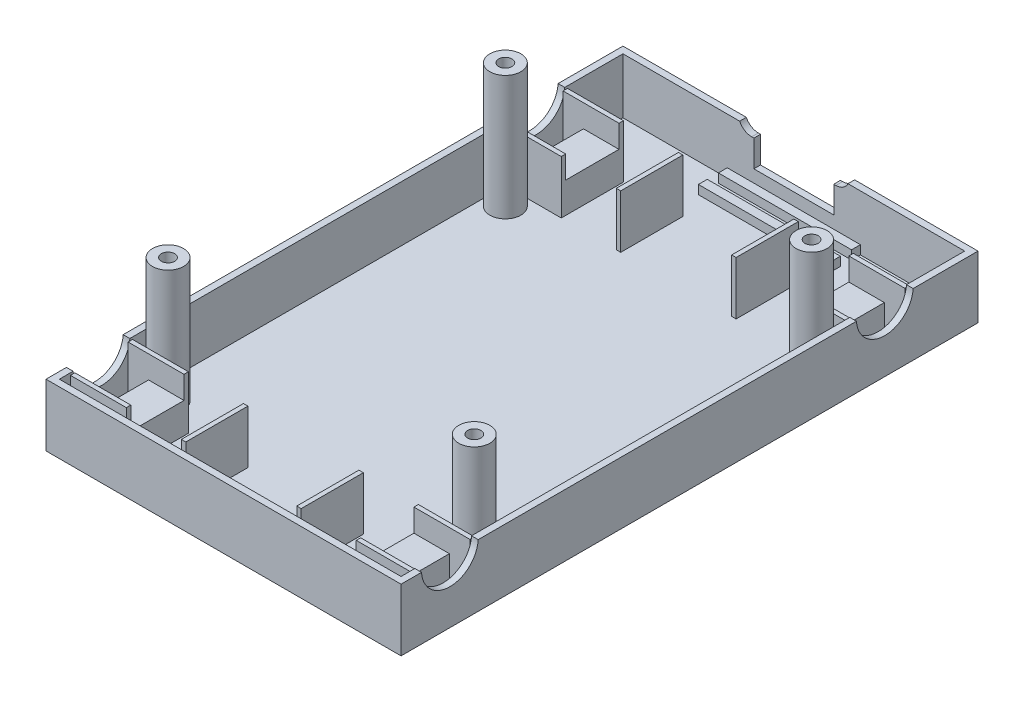
from build123d import *

# Parameters (mm, degrees)
SKETCH_262_W         = 80
SKETCH_262_H         = 130
EXTRUDE_1_DEPTH      = 14
SKETCH_1_W           = 77
SKETCH_1_H           = 127
CUT_EXTRUDE_1_DEPTH  = 12.5
CUT_EXTRUDE_2_DEPTH  = 2
SKETCH_10_W          = 8
SKETCH_10_H          = 12
EXTRUDE_2_DEPTH      = 6.9
SKETCH_11_W          = 12.6
SKETCH_11_H          = 1
EXTRUDE_3_DEPTH      = 12
SKETCH_13_R          = 3.5
EXTRUDE_4_DEPTH      = 28
CUT_EXTRUDE_9_DEPTH  = 1.5
CUT_EXTRUDE_START    = -1.5
CUT_EXTRUDE_10_DEPTH = 1.5
CUT_EXTRUDE_11_DEPTH = 1.5
CUT_EXTRUDE_12_DEPTH = 1.5
SKETCH_15_R          = 1.5
CUT_EXTRUDE_14_DEPTH = 19.5
SKETCH_16_W          = 30
SKETCH_16_H          = 2
EXTRUDE_5_DEPTH      = 2
SKETCH_17_W          = 1
SKETCH_17_H          = 14
EXTRUDE_6_DEPTH      = 12


with BuildPart() as part:
    # Sketch 262 → Бобышка-Вытянуть1 (new body)
    with BuildSketch(Plane(origin=(0, 0, 0), x_dir=(1, 0, 0), z_dir=(0, 1, 0))):
        Rectangle(SKETCH_262_W, SKETCH_262_H)
    extrude(amount=EXTRUDE_1_DEPTH)

    # Эскиз1 → Вырез-Вытянуть1 (cut)
    with BuildSketch(Plane(origin=(0, 14, 0), x_dir=(1, 0, 0), z_dir=(0, 1, 0))):
        Rectangle(SKETCH_1_W, SKETCH_1_H)
    extrude(amount=-CUT_EXTRUDE_1_DEPTH, mode=Mode.SUBTRACT)

    # Эскиз2 → Вырез-Вытянуть2 (cut)
    with BuildSketch(Plane.XY.offset(-63.5)):
        with BuildLine():
            Line((-9, 18.3), (-9.5, 18.3))
            ThreePointArc((-9.5, 18.3), (-12.5, 15.3), (-9.5, 12.3))
            Line((-9.5, 12.3), (-9, 12.3))
            Line((-9, 12.3), (-9, 6.3))
            Line((-9, 6.3), (9, 6.3))
            Line((9, 6.3), (9, 12.3))
            Line((9, 12.3), (9.5, 12.3))
            ThreePointArc((9.5, 12.3), (12.5, 15.3), (9.5, 18.3))
            Line((9.5, 18.3), (9, 18.3))
            Line((9, 18.3), (9, 24.3))
            Line((9, 24.3), (-9, 24.3))
            Line((-9, 24.3), (-9, 18.3))
        make_face()
    extrude(amount=-CUT_EXTRUDE_2_DEPTH, mode=Mode.SUBTRACT)

    # Эскиз10 → Бобышка-Вытянуть2 (add)
    with BuildSketch(Plane(origin=(0, 1.5, 0), x_dir=(1, 0, 0), z_dir=(0, 1, 0))):
        with Locations((-29.9, 44)):
            Rectangle(SKETCH_10_W, SKETCH_10_H)
        with Locations((29.9, 44)):
            Rectangle(SKETCH_10_W, SKETCH_10_H)
        with Locations((-29.9, -54)):
            Rectangle(SKETCH_10_W, SKETCH_10_H)
        with Locations((29.9, -54)):
            Rectangle(SKETCH_10_W, SKETCH_10_H)
    extrude(amount=EXTRUDE_2_DEPTH)

    # Эскиз11 → Бобышка-Вытянуть3 (add)
    with BuildSketch(Plane(origin=(0, 1.5, 0), x_dir=(1, 0, 0), z_dir=(0, 1, 0))):
        with Locations((-32.2, 50.5)):
            Rectangle(SKETCH_11_W, SKETCH_11_H)
        with Locations((32.2, 50.5)):
            Rectangle(SKETCH_11_W, SKETCH_11_H)
        with Locations((-32.2, 37.5)):
            Rectangle(SKETCH_11_W, SKETCH_11_H)
        with Locations((32.2, 37.5)):
            Rectangle(SKETCH_11_W, SKETCH_11_H)
        with Locations((32.2, -47.5)):
            Rectangle(SKETCH_11_W, SKETCH_11_H)
        with Locations((32.2, -60.5)):
            Rectangle(SKETCH_11_W, SKETCH_11_H)
        with Locations((-32.2, -47.5)):
            Rectangle(SKETCH_11_W, SKETCH_11_H)
        with Locations((-32.2, -60.5)):
            Rectangle(SKETCH_11_W, SKETCH_11_H)
    extrude(amount=EXTRUDE_3_DEPTH)

    # Эскиз13 → Бобышка-Вытянуть4 (add)
    with BuildSketch(Plane(origin=(0, 1.5, 0), x_dir=(1, 0, 0), z_dir=(0, 1, 0))):
        with Locations(Location((-34.5, 33, 0), (0, 0, 270))):
            Circle(SKETCH_13_R)
        with Locations(Location((34.5, 33, 0), (0, 0, 270))):
            Circle(SKETCH_13_R)
        with Locations(Location((-34.5, -43, 0), (0, 0, 270))):
            Circle(SKETCH_13_R)
        with Locations(Location((34.5, -43, 0), (0, 0, 270))):
            Circle(SKETCH_13_R)
    extrude(amount=EXTRUDE_4_DEPTH)

    # Эскиз5 → Вырез-Вытянуть9 (cut)
    with BuildSketch(Plane.ZY.offset(40)):
        with BuildLine():
            Line((57.199546833, 20.146147769), (57.196157558, 19.944779244))
            ThreePointArc((57.196157558, 19.944779244), (54, 8), (50.803842442, 19.944779244))
            Line((50.803842442, 19.944779244), (50.800453167, 20.146147769))
            ThreePointArc((50.800453167, 20.146147769), (54, 23.4), (57.199546833, 20.146147769))
        make_face()
    extrude(amount=-CUT_EXTRUDE_9_DEPTH, mode=Mode.SUBTRACT)

    # Эскиз6 → Вырез-Вытянуть10 (cut)
    with BuildSketch(Plane(origin=(40, 0, 0), x_dir=(0, 0, -1), z_dir=(1, 0, 0)).offset(CUT_EXTRUDE_START)):
        with BuildLine():
            Line((-50.8, 20.2), (-50.8, 19.942562584))
            ThreePointArc((-50.8, 19.942562584), (-54, 8), (-57.2, 19.942562584))
            Line((-57.2, 19.942562584), (-57.2, 20.2))
            ThreePointArc((-57.2, 20.2), (-54, 23.4), (-50.8, 20.2))
        make_face()
    extrude(amount=CUT_EXTRUDE_10_DEPTH, mode=Mode.SUBTRACT)

    # Эскиз3 → Вырез-Вытянуть11 (cut)
    with BuildSketch(Plane.ZY.offset(40)):
        with BuildLine():
            Line((-40.8, 20.2), (-40.8, 19.942562584))
            ThreePointArc((-40.8, 19.942562584), (-44, 8), (-47.2, 19.942562584))
            Line((-47.2, 19.942562584), (-47.2, 20.2))
            ThreePointArc((-47.2, 20.2), (-44, 23.4), (-40.8, 20.2))
        make_face()
    extrude(amount=-CUT_EXTRUDE_11_DEPTH, mode=Mode.SUBTRACT)

    # Эскиз9 → Вырез-Вытянуть12 (cut)
    with BuildSketch(Plane(origin=(40, 0, 0), x_dir=(0, 0, -1), z_dir=(1, 0, 0)).offset(CUT_EXTRUDE_START)):
        with BuildLine():
            Line((47.2, 20.2), (47.2, 19.942562584))
            ThreePointArc((47.2, 19.942562584), (44, 8), (40.8, 19.942562584))
            Line((40.8, 19.942562584), (40.8, 20.2))
            ThreePointArc((40.8, 20.2), (44, 23.4), (47.2, 20.2))
        make_face()
    extrude(amount=CUT_EXTRUDE_12_DEPTH, mode=Mode.SUBTRACT)

    # Эскиз15 → Вырез-Вытянуть14 (cut)
    with BuildSketch(Plane(origin=(0, 29.5, 0), x_dir=(1, 0, 0), z_dir=(0, 1, 0))):
        with Locations(Location((-34.5, 33, 0), (0, 0, 270))):
            Circle(SKETCH_15_R)
        with Locations(Location((34.5, 33, 0), (0, 0, 270))):
            Circle(SKETCH_15_R)
        with Locations(Location((34.5, -43, 0), (0, 0, 270))):
            Circle(SKETCH_15_R)
        with Locations(Location((-34.5, -43, 0), (0, 0, 270))):
            Circle(SKETCH_15_R)
    extrude(amount=-CUT_EXTRUDE_14_DEPTH, mode=Mode.SUBTRACT)

    # Эскиз16 → Бобышка-Вытянуть5 (add)
    with BuildSketch(Plane(origin=(0, 1.5, 0), x_dir=(1, 0, 0), z_dir=(0, 1, 0))):
        with Locations((0, 62.5)):
            Rectangle(SKETCH_16_W, SKETCH_16_H)
        with Locations((0, 58)):
            Rectangle(SKETCH_16_W, SKETCH_16_H)
    extrude(amount=EXTRUDE_5_DEPTH)

    # Эскиз17 → Бобышка-Вытянуть6 (add)
    with BuildSketch(Plane(origin=(0, 1.5, 0), x_dir=(1, 0, 0), z_dir=(0, 1, 0))):
        with Locations((-13, 44)):
            Rectangle(SKETCH_17_W, SKETCH_17_H)
        with Locations((13, 44)):
            Rectangle(SKETCH_17_W, SKETCH_17_H)
        with Locations((-13, -54)):
            Rectangle(SKETCH_17_W, SKETCH_17_H)
        with Locations((13, -54)):
            Rectangle(SKETCH_17_W, SKETCH_17_H)
    extrude(amount=EXTRUDE_6_DEPTH)


solid = part.part
